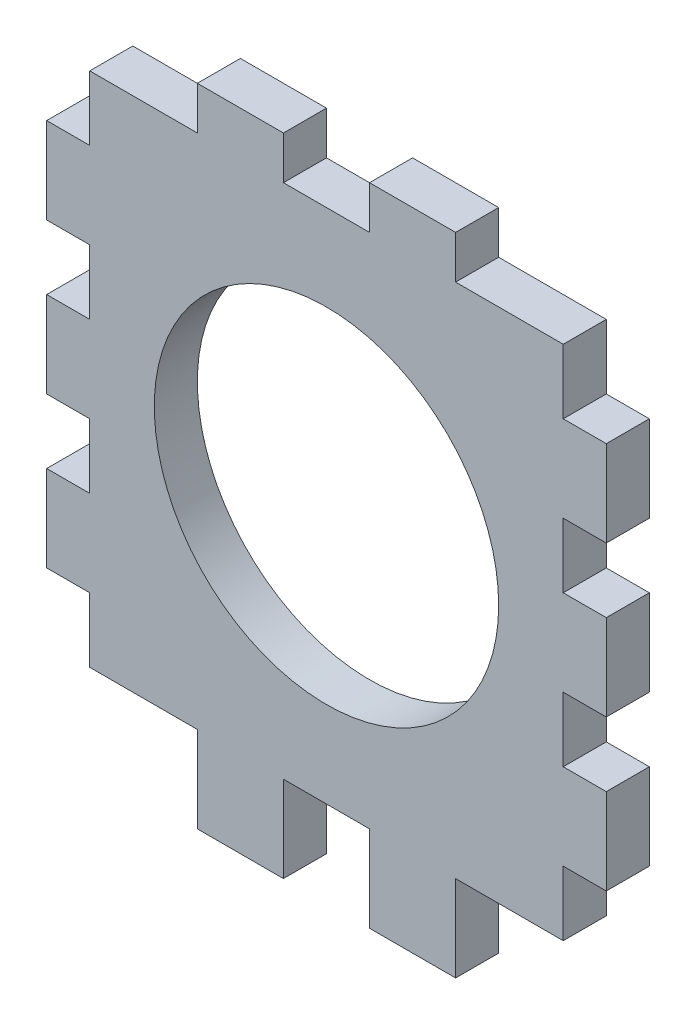
from build123d import *

# Parameters (mm, degrees)
SKETCH1_R           = 10
BOSS_EXTRUDE1_DEPTH = 2.5


with BuildPart() as part:
    # Sketch1 → Boss-Extrude1 (new body)
    with BuildSketch(Plane.XY):
        Polygon((-2.5, -20), (-2.5, -15), (2.5, -15), (2.5, -20), (7.5, -20), (7.5, -15), (13.75, -15), (13.75, -11.25), (16.25, -11.25), (16.25, -6.25), (13.75, -6.25), (13.75, -2.5), (16.25, -2.5), (16.25, 2.5), (13.75, 2.5), (13.75, 6.25), (16.25, 6.25), (16.25, 11.25), (13.75, 11.25), (13.75, 15), (7.5, 15), (7.5, 17.5), (2.5, 17.5), (2.5, 15), (-2.5, 15), (-2.5, 17.5), (-7.5, 17.5), (-7.5, 15), (-13.75, 15), (-13.75, 11.25), (-16.25, 11.25), (-16.25, 6.25), (-13.75, 6.25), (-13.75, 2.5), (-16.25, 2.5), (-16.25, -2.5), (-13.75, -2.5), (-13.75, -6.25), (-16.25, -6.25), (-16.25, -11.25), (-13.75, -11.25), (-13.75, -15), (-7.5, -15), (-7.5, -20), align=None)
        Circle(SKETCH1_R, mode=Mode.SUBTRACT)
    extrude(amount=BOSS_EXTRUDE1_DEPTH)


solid = part.part
